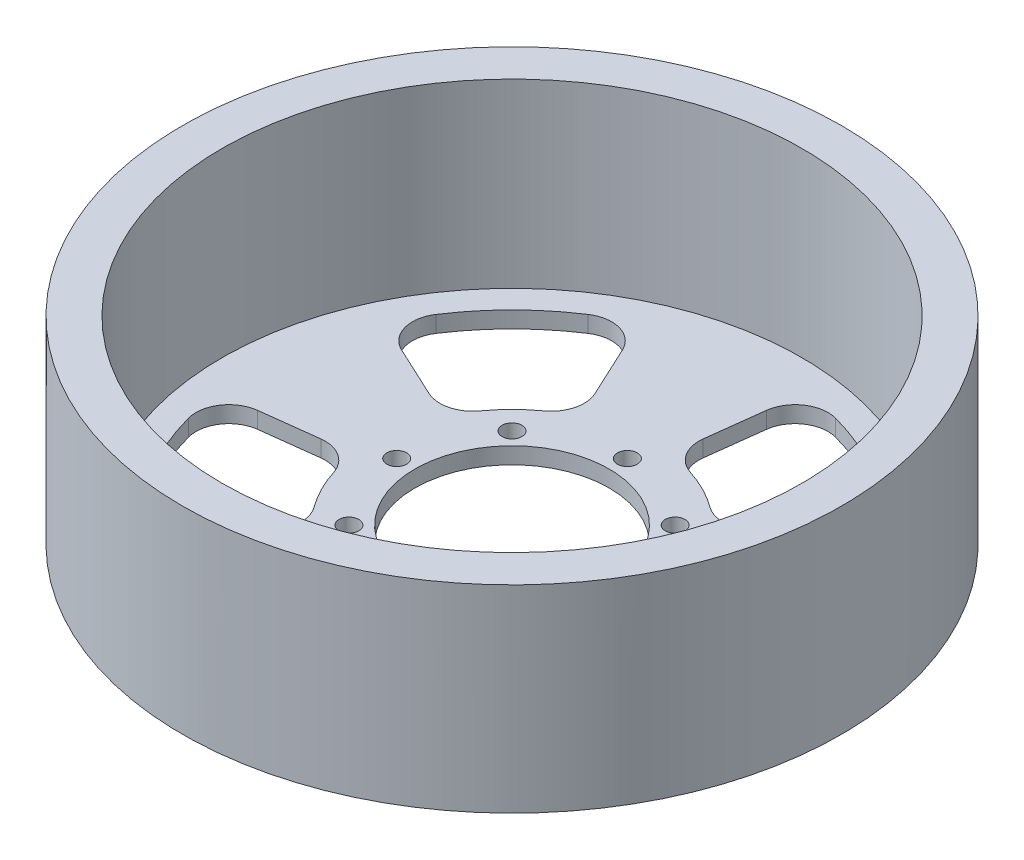
from build123d import *

# Parameters (mm, degrees)
SKETCH_1_R                       = 50
EXTRUDE_1_DEPTH                  = 50
SKETCH_2_R                       = 44
CUT_EXTRUDE_1_DEPTH              = 37.5
CUT_EXTRUDE_START                = -9.5
SKETCH_3_R                       = 44
CUT_EXTRUDE_2_DEPTH              = 9.5
SKETCH_4_R                       = 14.75
SKETCH_4_R_2                     = 1.5
CUT_EXTRUDE_3_DEPTH              = 4
CUT_EXTRUDE_4_DEPTH              = 4
FILLET_1_R                       = 5
PATTERN_CIRCULAR_1_COUNT         = 5
FILLET_1_OF_PATTERN_CIRCULAR_1_R = 5
SKETCH_11_R                      = 59.165085767
CUT_EXTRUDE_8_DEPTH              = 10
SKETCH_15_R                      = 58.048743464
CUT_EXTRUDE_10_DEPTH             = 10


with BuildPart() as part:
    # 草图1 → 凸台-拉伸1 (new body)
    with BuildSketch(Plane(origin=(0, 0, 0), x_dir=(1, 0, 0), z_dir=(0, 1, 0))):
        with Locations(Location((0, 0, 0), (0, 0, 270))):
            Circle(SKETCH_1_R)
    extrude(amount=EXTRUDE_1_DEPTH)

    # 草图2 → 切除-拉伸1 (cut)
    with BuildSketch(Plane(origin=(0, 50, 0), x_dir=(1, 0, 0), z_dir=(0, 1, 0))):
        with Locations(Location((0, 0, 0), (0, 0, 270))):
            Circle(SKETCH_2_R)
    extrude(amount=-CUT_EXTRUDE_1_DEPTH, mode=Mode.SUBTRACT)

    # 草图3 → 切除-拉伸2 (cut)
    with BuildSketch(Plane.XZ.offset(CUT_EXTRUDE_START)):
        with Locations(Location((0, 0, 0), (0, 0, 90))):
            Circle(SKETCH_3_R)
    extrude(amount=CUT_EXTRUDE_2_DEPTH, mode=Mode.SUBTRACT)

    # 草图4 → 切除-拉伸3 (cut)
    with BuildSketch(Plane(origin=(0, 12.5, 0), x_dir=(1, 0, 0), z_dir=(0, 1, 0))):
        with Locations(Location((0, 0, 0), (0, 0, 270))):
            Circle(SKETCH_4_R)
        with Locations(Location((0, 17.5, 0), (0, 0, 270))):
            Circle(SKETCH_4_R_2)
        with Locations(Location((12.374368671, 12.374368671, 0), (0, 0, 270))):
            Circle(SKETCH_4_R_2)
        with Locations(Location((17.5, 0, 0), (0, 0, 270))):
            Circle(SKETCH_4_R_2)
        with Locations(Location((12.374368671, -12.374368671, 0), (0, 0, 270))):
            Circle(SKETCH_4_R_2)
        with Locations(Location((0, -17.5, 0), (0, 0, 270))):
            Circle(SKETCH_4_R_2)
        with Locations(Location((-12.374368671, -12.374368671, 0), (0, 0, 270))):
            Circle(SKETCH_4_R_2)
        with Locations(Location((-17.5, 0, 0), (0, 0, 270))):
            Circle(SKETCH_4_R_2)
        with Locations(Location((-12.374368671, 12.374368671, 0), (0, 0, 270))):
            Circle(SKETCH_4_R_2)
    extrude(amount=-CUT_EXTRUDE_3_DEPTH, mode=Mode.SUBTRACT)

    # 草图8 → 切除-拉伸4 (cut)
    with BuildSketch(Plane(origin=(0, 12.5, 0), x_dir=(1, 0, 0), z_dir=(0, 1, 0))):
        with BuildLine():
            Line((4.874773736, 39.701846066), (2.620190883, 21.33974226))
            ThreePointArc((2.620190883, 21.33974226), (9.760795744, 19.15664027), (15.724104585, 14.662964741))
            Line((15.724104585, 14.662964741), (29.254148065, 27.279934402))
            ThreePointArc((29.254148065, 27.279934402), (18.15961999, 35.640260968), (4.874773736, 39.701846066))
        make_face()
    cut_extrude_4 = extrude(amount=-CUT_EXTRUDE_4_DEPTH, mode=Mode.SUBTRACT)

    # 圆角1
    fillet_1_edges = [part.edges().sort_by_distance(p)[0] for p in [
        (29.254148065, 11, -27.279934402),
        (15.724104585, 11, -14.662964741),
        (2.620190883, 11, -21.33974226),
        (4.874773736, 11, -39.701846066),
    ]]
    fillet(fillet_1_edges, radius=FILLET_1_R)

    # 阵列(圆周)1: 切除-拉伸4 ×5 about axis
    pattern_circular_1_axis = Axis((0, 0, 0), (0, 1, 0))
    for i in range(1, PATTERN_CIRCULAR_1_COUNT):
        add(cut_extrude_4.rotate(pattern_circular_1_axis, i * 360 / PATTERN_CIRCULAR_1_COUNT), mode=Mode.SUBTRACT)

    # 圆角1 of 阵列(圆周)1
    fillet_1_of_pattern_circular_1_edges = [part.edges().sort_by_distance(p)[0] for p in [
        (-16.90473047, 11, -36.252311481),
        (-9.086292627, 11, -19.485617421),
        (-19.485617421, 11, -9.086292627),
        (-36.252311481, 11, -16.90473047),
        (-39.701846066, 11, 4.874773736),
        (-21.33974226, 11, 2.620190883),
        (-14.662964741, 11, 15.724104585),
        (-27.279934402, 11, 29.254148065),
        (-7.632359815, 11, 39.265087338),
        (-4.102393401, 11, 21.104984444),
        (10.423406835, 11, 18.804323703),
        (19.39238481, 11, 34.984788286),
        (34.984788286, 11, 19.39238481),
        (18.804323703, 11, 10.423406835),
        (21.104984444, 11, -4.102393401),
        (39.265087338, 11, -7.632359815),
    ]]
    fillet(fillet_1_of_pattern_circular_1_edges, radius=FILLET_1_OF_PATTERN_CIRCULAR_1_R)

    # 草图11 → 切除-拉伸8 (cut)
    with BuildSketch(Plane.XZ):
        Circle(SKETCH_11_R)
    extrude(amount=-CUT_EXTRUDE_8_DEPTH, mode=Mode.SUBTRACT)

    # 草图15 → 切除-拉伸10 (cut)
    with BuildSketch(Plane(origin=(0, 50, 0), x_dir=(1, 0, 0), z_dir=(0, 1, 0))):
        Circle(SKETCH_15_R)
    extrude(amount=-CUT_EXTRUDE_10_DEPTH, mode=Mode.SUBTRACT)


solid = part.part
